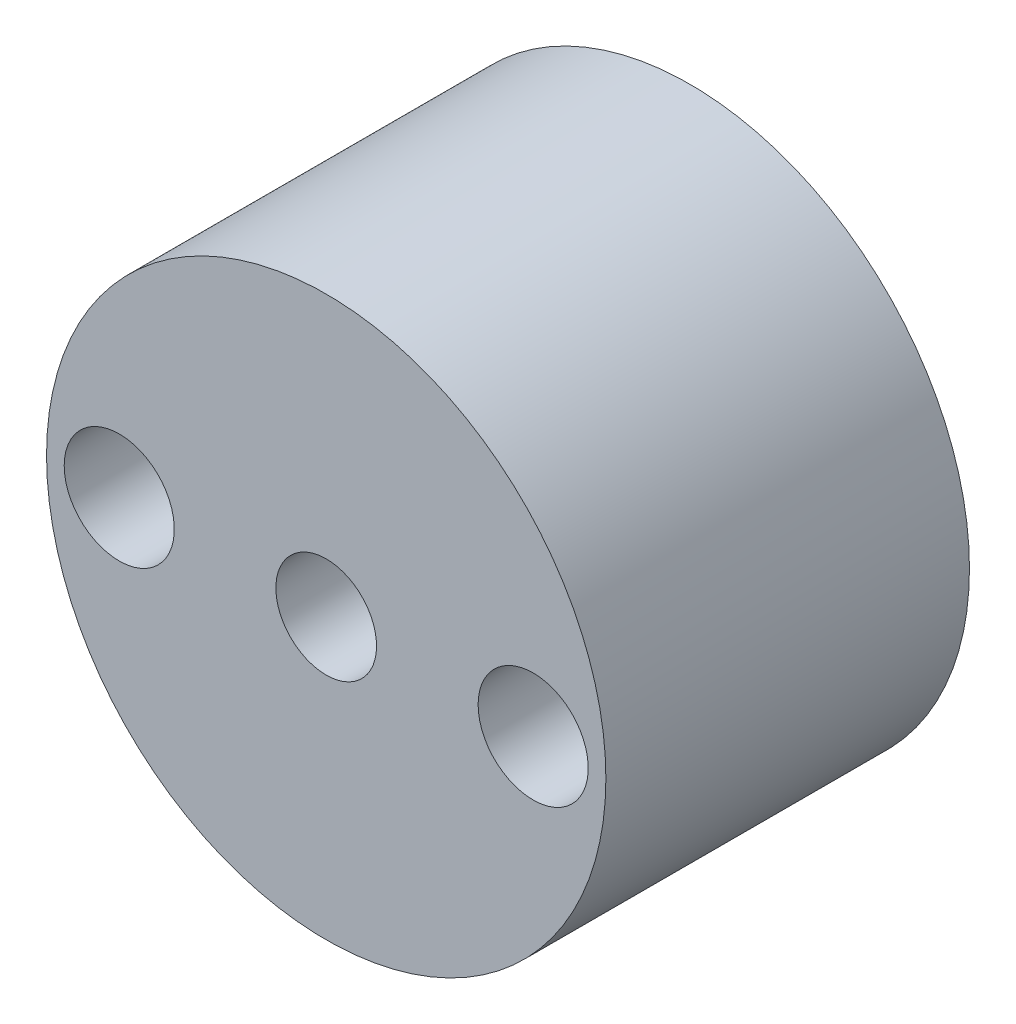
from build123d import *

# Parameters (mm, degrees)
SKETCH1_R               = 6.35
BOSS_EXTRUDE1_DEPTH     = 5.08
SKETCH2_R               = 6.35
SKETCH2_R_2             = 1.143
BOSS_EXTRUDE2_DEPTH     = 3.175
TAP_DRILL_FOR_M3_TAP2_D = 2.5


with BuildPart() as part:
    # Sketch1 → Boss-Extrude1 (new body)
    with BuildSketch(Plane.XY):
        Circle(SKETCH1_R)
        with BuildLine():
            Line((-2.413, -2.54), (-2.413, 2.54))
            ThreePointArc((-2.413, 2.54), (0, 3.503451013), (2.413, 2.54))
            Line((2.413, 2.54), (2.413, -2.54))
            ThreePointArc((2.413, -2.54), (0, -3.503451013), (-2.413, -2.54))
        make_face(mode=Mode.SUBTRACT)
    extrude(amount=BOSS_EXTRUDE1_DEPTH)

    # Sketch2 → Boss-Extrude2 (add)
    with BuildSketch(Plane.XY.offset(5.08)):
        Circle(SKETCH2_R)
        Circle(SKETCH2_R_2, mode=Mode.SUBTRACT)
    extrude(amount=BOSS_EXTRUDE2_DEPTH)

    # Tap Drill for M3 Tap2 (through all)
    with Locations(Plane(origin=(0, 0, 0), x_dir=(-1, 0, 0), z_dir=(0, 0, -1))):
        with Locations((-4.699, 0), (4.699, 0)):
            Hole(TAP_DRILL_FOR_M3_TAP2_D / 2)


solid = part.part
